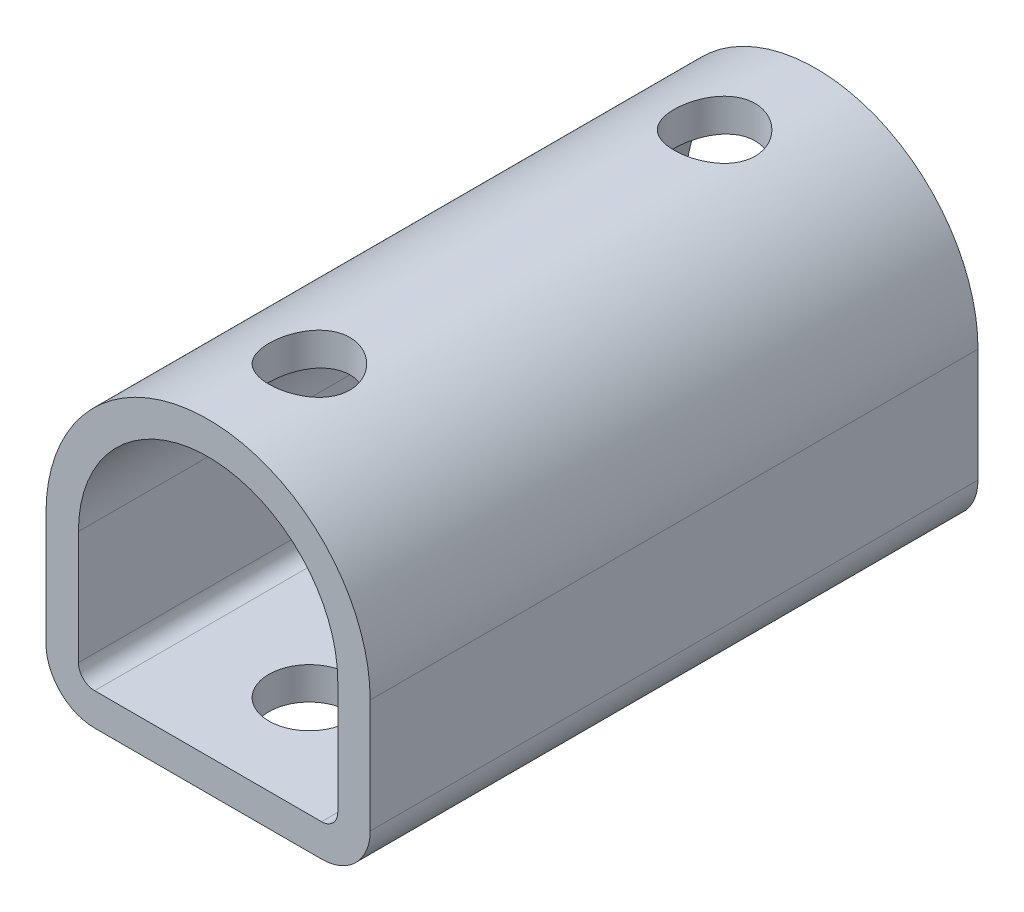
from build123d import *

# Parameters (mm, degrees)
BOSS_EXTRUDE2_DEPTH        = 37.5
F_10_0_10_DIAMETER_HOLE1_D = 10


with BuildPart() as part:
    # Sketch1 → Boss-Extrude2 (new, symmetric)
    with BuildSketch(Plane.XY):
        with BuildLine():
            Line((-20, 0), (-20, -14))
            ThreePointArc((-20, -14), (-18.242640687, -18.242640687), (-14, -20))
            Line((-14, -20), (14, -20))
            ThreePointArc((14, -20), (18.242640687, -18.242640687), (20, -14))
            Line((20, -14), (20, 0))
            ThreePointArc((20, 0), (0, 20), (-20, 0))
        make_face()
        with BuildLine():
            Line((-16, 0), (-16, -14))
            ThreePointArc((-16, -14), (-15.414213562, -15.414213562), (-14, -16))
            Line((-14, -16), (14, -16))
            ThreePointArc((14, -16), (15.414213562, -15.414213562), (16, -14))
            Line((16, -14), (16, 0))
            ThreePointArc((16, 0), (0, 16), (-16, 0))
        make_face(mode=Mode.SUBTRACT)
    extrude(amount=BOSS_EXTRUDE2_DEPTH, both=True)

    # Ø10.0 (10) Diameter Hole1 (through all)
    with Locations(Plane(origin=(0, -20, 0), x_dir=(-1, 0, 0), z_dir=(0, -1, 0))):
        with Locations((0, 25), (0, -25)):
            Hole(F_10_0_10_DIAMETER_HOLE1_D / 2)


solid = part.part
